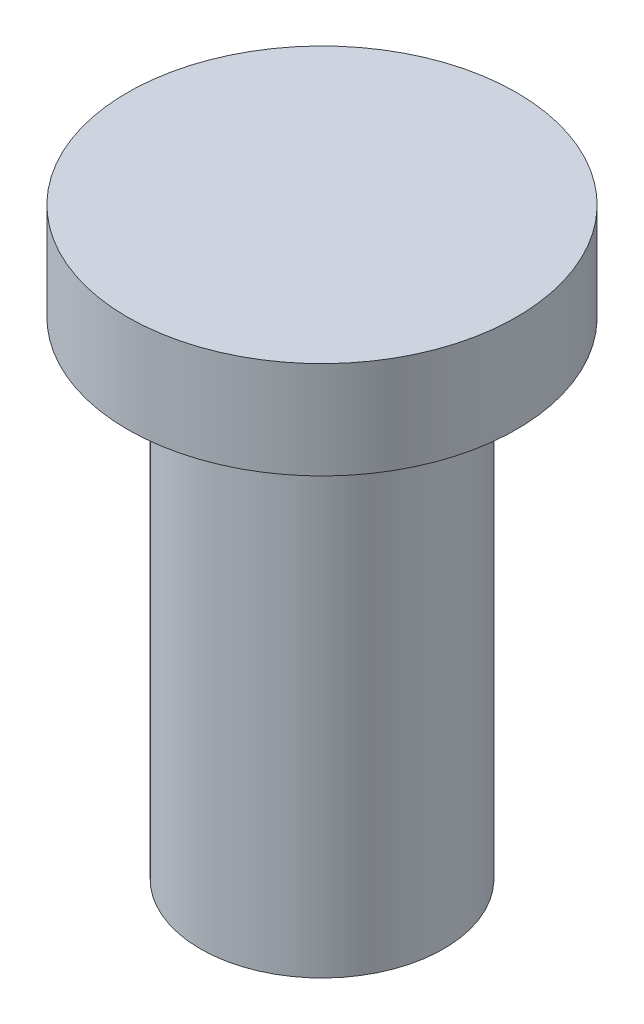
from build123d import *

# Parameters (mm, degrees)
SKETCH3_R           = 1.25
BOSS_EXTRUDE1_DEPTH = 5
SKETCH4_R           = 2
BOSS_EXTRUDE2_DEPTH = 1


with BuildPart() as part:
    # Sketch3 → Boss-Extrude1 (new body)
    with BuildSketch(Plane(origin=(0, 0, 0), x_dir=(1, 0, 0), z_dir=(0, 1, 0))):
        with Locations(Location((0, 0, 0), (0, 0, 270))):
            Circle(SKETCH3_R)
    extrude(amount=BOSS_EXTRUDE1_DEPTH)

    # Sketch4 → Boss-Extrude2 (add)
    with BuildSketch(Plane(origin=(0, 5, 0), x_dir=(1, 0, 0), z_dir=(0, 1, 0))):
        with Locations(Location((0, 0, 0), (0, 0, 270))):
            Circle(SKETCH4_R)
    extrude(amount=BOSS_EXTRUDE2_DEPTH)


solid = part.part
